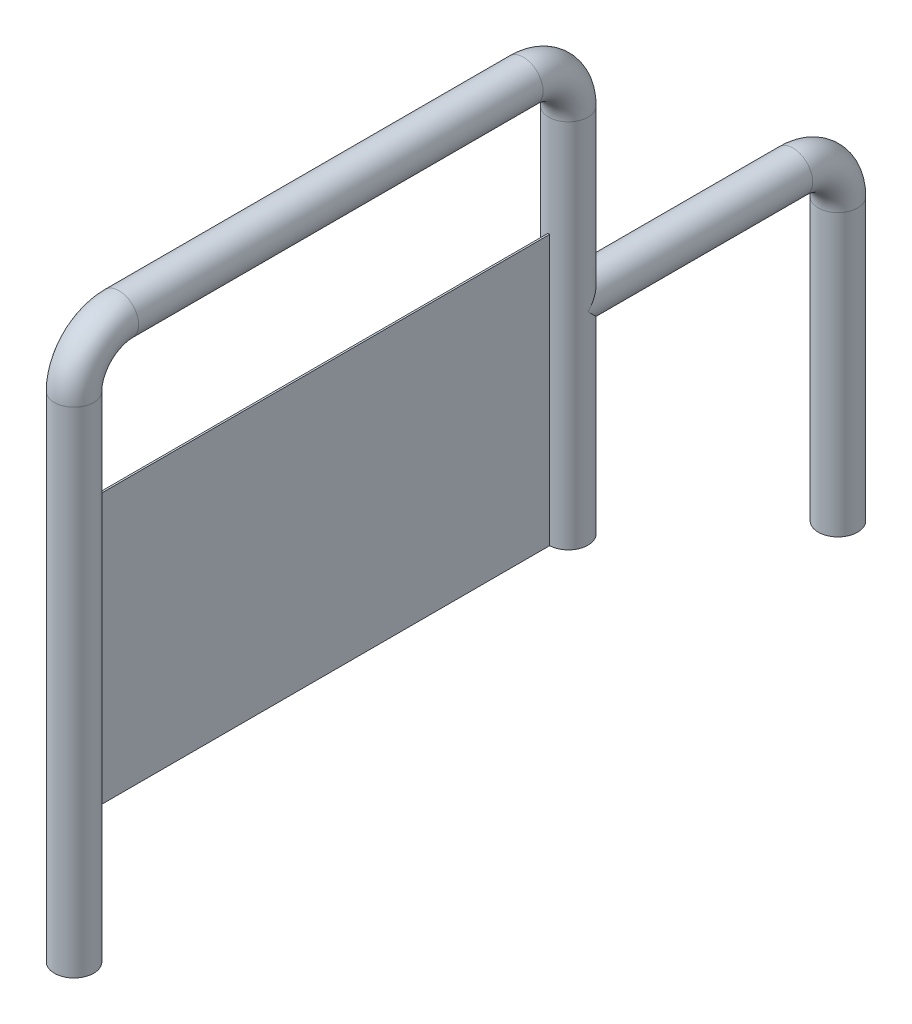
from build123d import *

# Parameters (mm, degrees)
SKETCH2_R                = 11.1125
SKETCH2_5_R              = 11.1125
BOSS_EXTRUDE1_DEPTH      = 0.508
BOSS_EXTRUDE1_DEPTH_BACK = 0.508
SKETCH3_W                = 257.175
SKETCH3_H                = 152.4


with BuildPart() as part:
    # Sweep1: sweep along a path in Sketch1
    with BuildLine(Plane(origin=(0, 0, 0), x_dir=(0, 0, -1), z_dir=(1, 0, 0))) as sweep1_path:
        Line((0, 0), (0, 279.4))
        ThreePointArc((0, 279.4), (7.439487758, 297.360512242), (25.4, 304.8))
        Line((25.4, 304.8), (254, 304.8))
        ThreePointArc((254, 304.8), (271.960512242, 297.360512242), (279.4, 279.4))
        Line((279.4, 279.4), (279.4, 184.15))
        Line((279.4, 184.15), (406.4, 184.15))
        ThreePointArc((406.4, 184.15), (424.360512242, 176.710512242), (431.8, 158.75))
        Line((431.8, 158.75), (431.8, 0))
    # Sketch2 → Sweep1 (sweep)
    with BuildSketch(Plane(origin=(0, 0, 0), x_dir=(1, 0, 0), z_dir=(0, 1, 0))):
        Circle(SKETCH2_R)
    sweep(path=sweep1_path.line, transition=Transition.RIGHT)

    # Sweep5: sweep along a path in Sketch1<9>
    with BuildLine(Plane(origin=(0, 0, 0), x_dir=(0, 0, -1), z_dir=(1, 0, 0))) as sweep5_path:
        Line((0, 0), (0, 279.4))
        ThreePointArc((0, 279.4), (7.439487758, 297.360512242), (25.4, 304.8))
        Line((25.4, 304.8), (254, 304.8))
        ThreePointArc((254, 304.8), (271.960512242, 297.360512242), (279.4, 279.4))
        Line((279.4, 279.4), (279.4, 184.15))
        Line((279.4, 184.15), (279.4, 69.85))
    # Sketch2<5> → Sweep5 (sweep)
    with BuildSketch(Plane(origin=(0, 0, 0), x_dir=(1, 0, 0), z_dir=(0, 1, 0))):
        Circle(SKETCH2_5_R)
    sweep(path=sweep5_path.line)


with BuildPart() as body_2:
    # Sketch3 → Boss-Extrude1 (new, two sides: drawn at the far end of the back side and taken through both)
    with BuildSketch(Plane(origin=(0, 0, 0), x_dir=(0, 0, -1), z_dir=(1, 0, 0)).offset(-BOSS_EXTRUDE1_DEPTH_BACK)):
        with Locations((139.7, 146.05)):
            Rectangle(SKETCH3_W, SKETCH3_H)
    extrude(amount=BOSS_EXTRUDE1_DEPTH + BOSS_EXTRUDE1_DEPTH_BACK)


solid = Compound([part.part, body_2.part])
